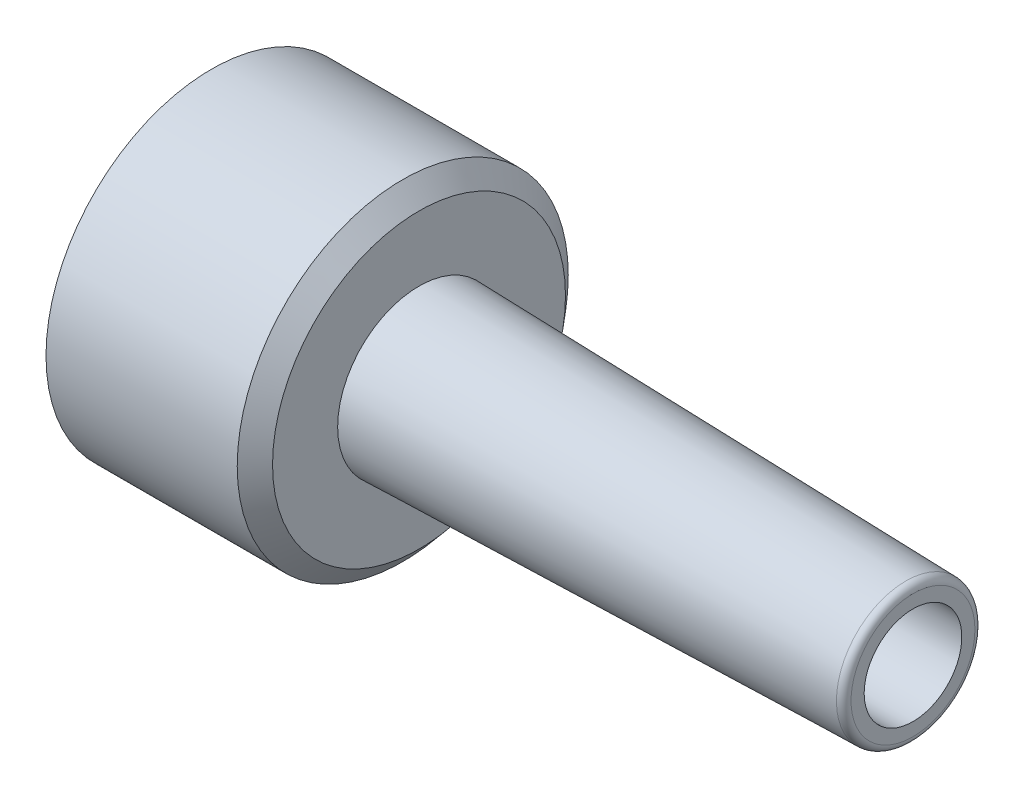
from build123d import *

# Parameters (mm, degrees)
FILLET1_R          = 2
FILLET2_R          = 1
SKETCH5_R          = 2.2
CUT_EXTRUDE1_DEPTH = 212.443107005


with BuildPart() as part:
    # Sketch2 → Revolve1 (revolve)
    with BuildSketch(Plane(origin=(0, 0, 0), x_dir=(1, 0, 0), z_dir=(0, 1, 0))):
        with BuildLine():
            Line((8.8, -32.1), (12.1, -44.75))
            Line((12.1, -44.75), (63.8, -44.75))
            Line((63.8, -44.75), (68.2, -39.6))
            Line((68.2, -39.6), (68.2, -22))
            Line((68.2, -22), (201.75, -18.7))
            Line((201.75, -18.7), (201.75, -13.2))
            Line((201.75, -13.2), (157.75, -13.2))
            ThreePointArc((157.75, -13.2), (157.031986163, -12.818013837), (156.65, -12.1))
            Line((156.65, -12.1), (156.25, -12.1))
            Line((156.25, -12.1), (156.25, -13.2))
            Line((156.25, -13.2), (155.15, -13.2))
            Line((155.15, -13.2), (155.15, -12.1))
            Line((155.15, -12.1), (131.05, -12.1))
            Line((131.05, -12.1), (131.05, -12.65))
            Line((131.05, -12.65), (129.95, -12.65))
            Line((129.95, -12.65), (129.95, -10.45))
            Line((129.95, -10.45), (56.1, -10.45))
            Line((56.1, -10.45), (56.1, -26))
            Line((56.1, -26), (51.7, -26))
            Line((51.7, -26), (51.7, -31))
            Line((51.7, -31), (23.1, -31))
            Line((23.1, -31), (23.1, -32.1))
            Line((23.1, -32.1), (8.8, -32.1))
        make_face()
    revolve(axis=Axis((0, 0, 0), (1, 0, 0)))

    # Fillet1
    fillet1_edges = [part.edges().sort_by_distance(p)[0] for p in [
        (201.75, 0, -18.7),
    ]]
    fillet(fillet1_edges, radius=FILLET1_R)

    # Fillet2
    fillet2_edges = [part.edges().sort_by_distance(p)[0] for p in [
        (51.7, 0, -31),
    ]]
    fillet(fillet2_edges, radius=FILLET2_R)

    # Sketch5 → Cut-Extrude1 (cut, through all)
    with BuildSketch(Plane.XY):
        with Locations((15.95, 0)):
            Circle(SKETCH5_R)
    extrude(amount=-CUT_EXTRUDE1_DEPTH, mode=Mode.SUBTRACT)


solid = part.part
